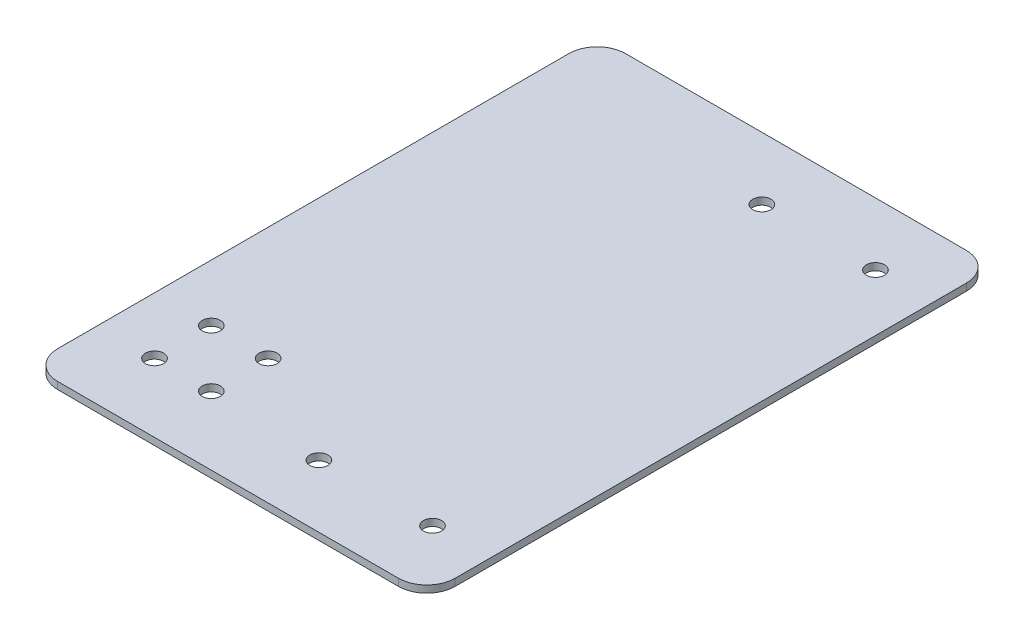
from build123d import *

# Parameters (mm, degrees)
SKETCH1_W           = 241.3
SKETCH1_H           = 127
SKETCH1_R           = 2.032
BOSS_EXTRUDE1_DEPTH = 1.5875
SKETCH2_W           = 152.4
SKETCH2_H           = 127
CUT_EXTRUDE1_DEPTH  = 137.349523858
FILLET2_R           = 6.35


with BuildPart() as part:
    # Sketch1 → Boss-Extrude1 (new body)
    with BuildSketch(Plane(origin=(0, 0, 0), x_dir=(1, 0, 0), z_dir=(0, 1, 0))):
        Rectangle(SKETCH1_W, SKETCH1_H)
        with Locations(Location((82.55, 49.53, 0), (0, 0, 270))):
            Circle(SKETCH1_R, mode=Mode.SUBTRACT)
        with Locations(Location((82.55, -49.53, 0), (0, 0, 270))):
            Circle(SKETCH1_R, mode=Mode.SUBTRACT)
        with Locations(Location((107.95, -49.53, 0), (0, 0, 270))):
            Circle(SKETCH1_R, mode=Mode.SUBTRACT)
        with Locations(Location((107.95, 49.53, 0), (0, 0, 270))):
            Circle(SKETCH1_R, mode=Mode.SUBTRACT)
        with Locations(Location((57.15, -35.4965, 0), (0, 0, 270))):
            Circle(SKETCH1_R, mode=Mode.SUBTRACT)
        with Locations(Location((44.45, -35.4965, 0), (0, 0, 270))):
            Circle(SKETCH1_R, mode=Mode.SUBTRACT)
        with Locations(Location((44.45, -48.1965, 0), (0, 0, 270))):
            Circle(SKETCH1_R, mode=Mode.SUBTRACT)
        with Locations(Location((57.15, -48.1965, 0), (0, 0, 270))):
            Circle(SKETCH1_R, mode=Mode.SUBTRACT)
    extrude(amount=BOSS_EXTRUDE1_DEPTH)

    # Sketch2 → Cut-Extrude1 (cut, through all)
    with BuildSketch(Plane(origin=(0, 1.5875, 0), x_dir=(1, 0, 0), z_dir=(0, 1, 0))):
        with Locations((-44.45, 0)):
            Rectangle(SKETCH2_W, SKETCH2_H)
    extrude(amount=-CUT_EXTRUDE1_DEPTH, mode=Mode.SUBTRACT)

    # Fillet2
    fillet2_edges = [part.edges().sort_by_distance(p)[0] for p in [
        (120.65, 0.79375, 63.5),
        (120.65, 0.79375, -63.5),
        (31.75, 0.79375, -63.5),
        (31.75, 0.79375, 63.5),
    ]]
    fillet(fillet2_edges, radius=FILLET2_R)


solid = part.part
